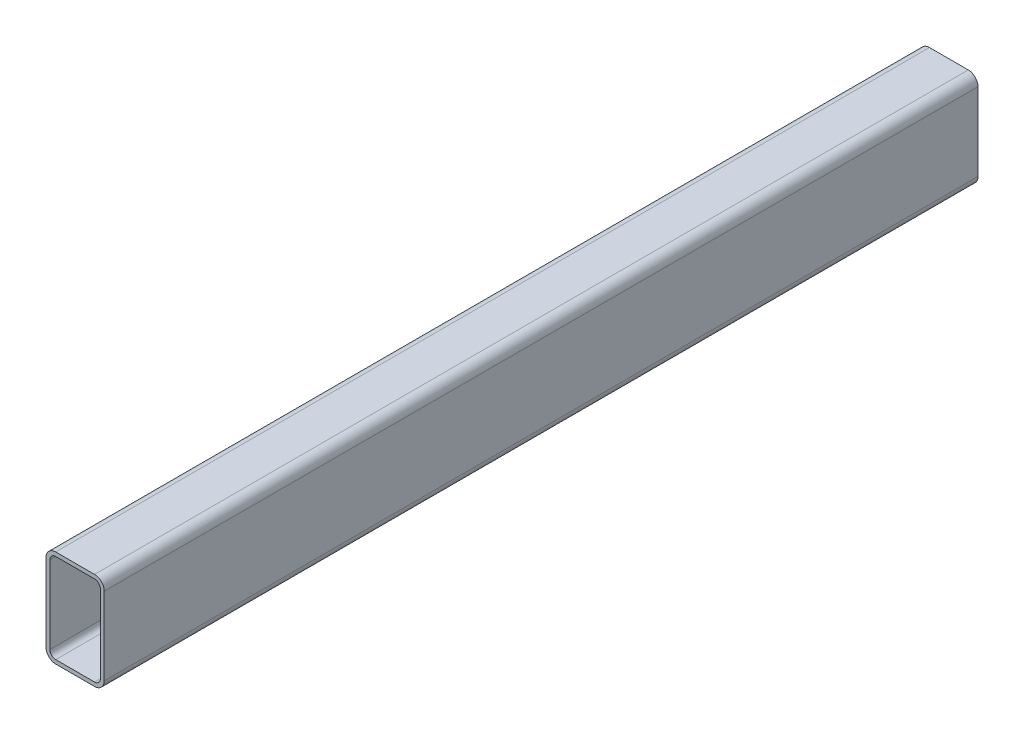
from build123d import *

# Parameters (mm, degrees)
BOSS_EXTRUDE1_DEPTH = 562.5


with BuildPart() as part:
    # Sketch1 → Boss-Extrude1 (new, symmetric)
    with BuildSketch(Plane.XY):
        with BuildLine():
            Line((-37.5, 0), (-37.5, -50))
            ThreePointArc((-37.5, -50), (-33.838834765, -58.838834765), (-25, -62.5))
            Line((-25, -62.5), (0, -62.5))
            Line((0, -62.5), (25, -62.5))
            ThreePointArc((25, -62.5), (33.838834765, -58.838834765), (37.5, -50))
            Line((37.5, -50), (37.5, 0))
            Line((37.5, 0), (37.5, 50))
            ThreePointArc((37.5, 50), (33.838834765, 58.838834765), (25, 62.5))
            Line((25, 62.5), (-25, 62.5))
            ThreePointArc((-25, 62.5), (-33.838834765, 58.838834765), (-37.5, 50))
            Line((-37.5, 50), (-37.5, 0))
        make_face()
        with BuildLine():
            Line((-32.5, 0), (-32.5, -50))
            ThreePointArc((-32.5, -50), (-30.303300859, -55.303300859), (-25, -57.5))
            Line((-25, -57.5), (0, -57.5))
            Line((0, -57.5), (25, -57.5))
            ThreePointArc((25, -57.5), (30.303300859, -55.303300859), (32.5, -50))
            Line((32.5, -50), (32.5, 0))
            Line((32.5, 0), (32.5, 50))
            ThreePointArc((32.5, 50), (30.303300859, 55.303300859), (25, 57.5))
            Line((25, 57.5), (-25, 57.5))
            ThreePointArc((-25, 57.5), (-30.303300859, 55.303300859), (-32.5, 50))
            Line((-32.5, 50), (-32.5, 0))
        make_face(mode=Mode.SUBTRACT)
    extrude(amount=BOSS_EXTRUDE1_DEPTH, both=True)


solid = part.part
